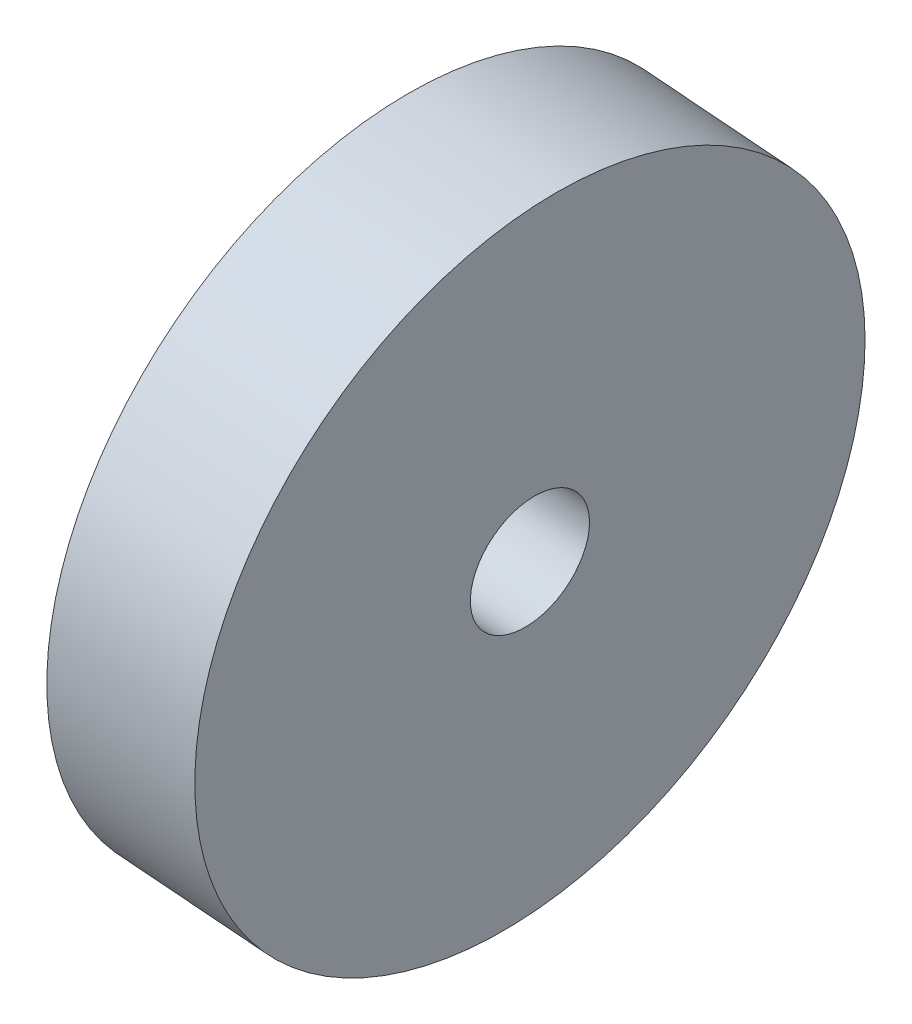
from build123d import *

# Parameters (mm, degrees)
SKETCH1_R           = 14.2875
BOSS_EXTRUDE1_DEPTH = 6.35
SKETCH2_R           = 2.54
CUT_EXTRUDE1_DEPTH  = 5.08


with BuildPart() as part:
    # Sketch1 → Boss-Extrude1 (new body)
    with BuildSketch(Plane(origin=(234.278878836, -18.689027227, 0), x_dir=(0, 0, -1), z_dir=(0.9968332748770866, -0.0795199477981641, 0))):
        with Locations(Location((-43.174261814, 8.550344032, 0), (0, 0, 90))):
            Circle(SKETCH1_R)
    extrude(amount=-BOSS_EXTRUDE1_DEPTH)

    # Sketch2 → Cut-Extrude1 (cut)
    with BuildSketch(Plane(origin=(234.278878836, -18.689027227, 0), x_dir=(0, 0, -1), z_dir=(0.9968332748770866, -0.07951994779816411, 0))):
        with Locations(Location((-43.174261814, 8.550344032, 0), (0, 0, 90))):
            Circle(SKETCH2_R)
    extrude(amount=-CUT_EXTRUDE1_DEPTH, mode=Mode.SUBTRACT)


solid = part.part
